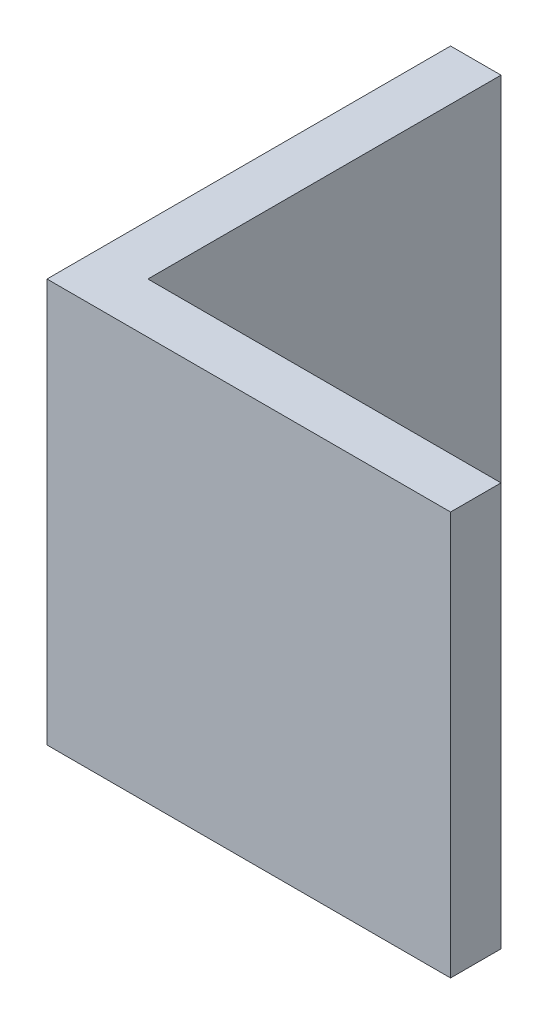
from build123d import *

# Parameters (mm, degrees)
BOSS_EXTRUDE1_DEPTH = 25.4


with BuildPart() as part:
    # Sketch1 → Boss-Extrude1 (new body)
    with BuildSketch(Plane(origin=(0, 0, 0), x_dir=(1, 0, 0), z_dir=(0, 1, 0))):
        Polygon((0, 0), (0, 25.4), (3.175, 25.4), (3.175, 3.175), (25.4, 3.175), (25.4, 0), align=None)
    extrude(amount=BOSS_EXTRUDE1_DEPTH)


solid = part.part
